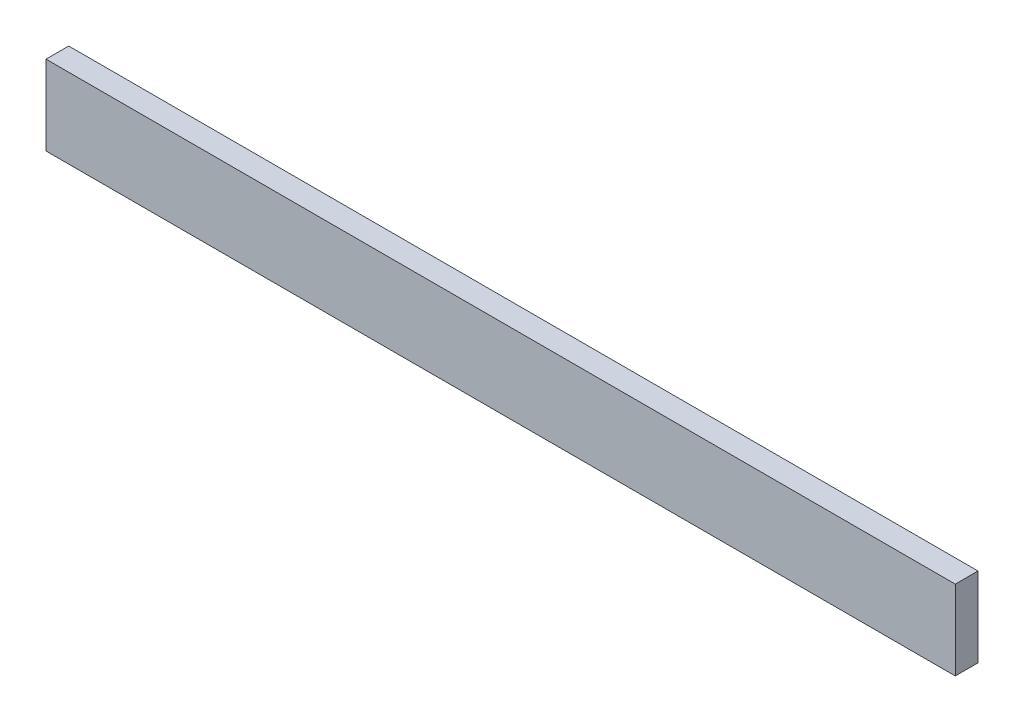
from build123d import *

# Parameters (mm, degrees)
SKETCH1_W           = 80
SKETCH1_H           = 7
BOSS_EXTRUDE1_DEPTH = 2


with BuildPart() as part:
    # Sketch1 → Boss-Extrude1 (new body)
    with BuildSketch(Plane.XY):
        Rectangle(SKETCH1_W, SKETCH1_H)
    extrude(amount=BOSS_EXTRUDE1_DEPTH)


solid = part.part
